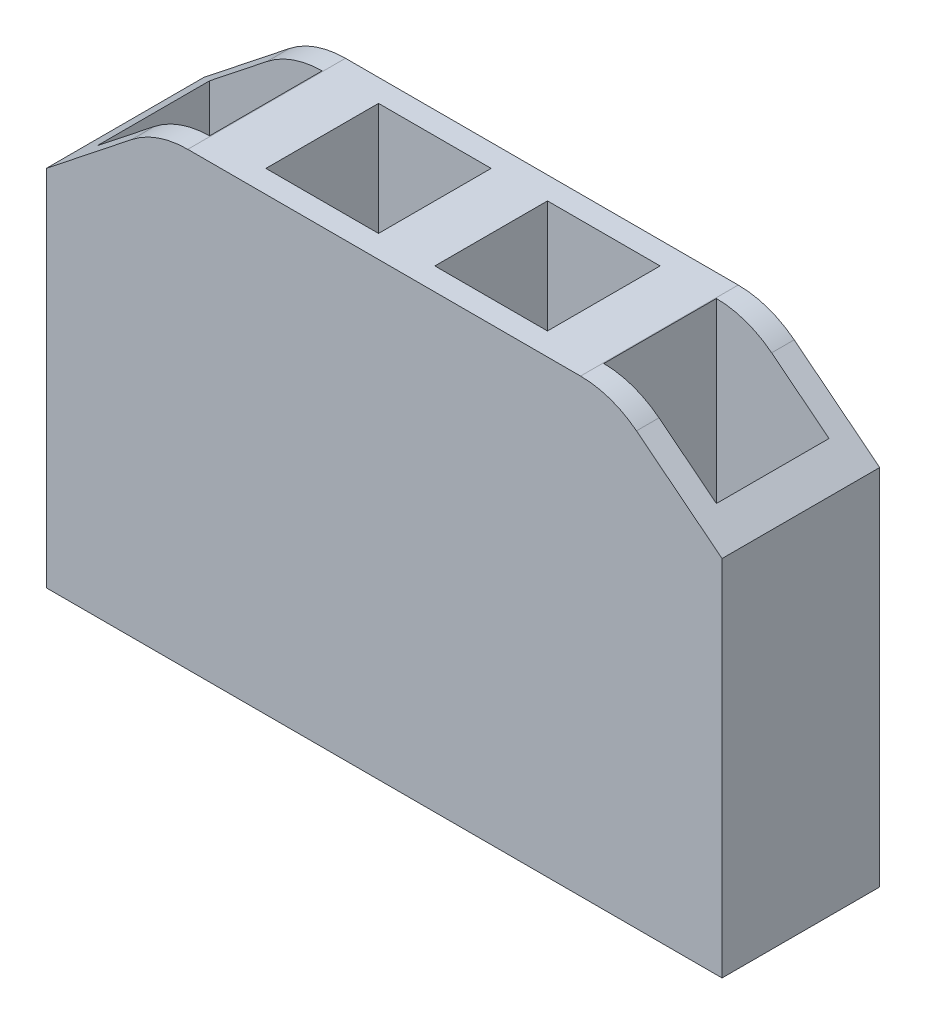
from build123d import *

# Parameters (mm, degrees)
SKETCH1_W               = 15
SKETCH1_H               = 3.5
BOSS_EXTRUDE1_DEPTH     = 10
CUT_EXTRUDE1_DEPTH      = 13.980754986
CUT_EXTRUDE1_DEPTH_BACK = 13.980754986
FILLET1_R               = 2
SKETCH3_W               = 2.5
SKETCH3_H               = 2.5
CUT_EXTRUDE2_DEPTH      = 8


with BuildPart() as part:
    # Sketch1 → Boss-Extrude1 (new body)
    with BuildSketch(Plane(origin=(0, 0, 0), x_dir=(1, 0, 0), z_dir=(0, 1, 0))):
        Rectangle(SKETCH1_W, SKETCH1_H)
    extrude(amount=BOSS_EXTRUDE1_DEPTH)

    # Sketch2 → Cut-Extrude1 (cut, two sides: drawn at the far end of the back side and taken through both)
    with BuildSketch(Plane.XY.offset(1.75).offset(-CUT_EXTRUDE1_DEPTH_BACK)):
        Polygon((-42.036351416, -19.295421035), (-7.5, 8.063187399), (-5.0550496, 10), (5.0550496, 10), (7.5, 8.063187399), (42.036351416, -19.295421035), (42.036351416, 68.823885013), (-42.036351416, 68.823885013), align=None)
    extrude(amount=CUT_EXTRUDE1_DEPTH + CUT_EXTRUDE1_DEPTH_BACK, mode=Mode.SUBTRACT)

    # Fillet1
    fillet1_edges = [part.edges().sort_by_distance(p)[0] for p in [
        (5.0550496, 10, 0),
        (-5.0550496, 10, 0),
    ]]
    fillet(fillet1_edges, radius=FILLET1_R)

    # Sketch3 → Cut-Extrude2 (cut)
    with BuildSketch(Plane(origin=(0, 10, 0), x_dir=(1, 0, 0), z_dir=(0, 1, 0))):
        with Locations((-1.875, 0)):
            Rectangle(SKETCH3_W, SKETCH3_H)
        with Locations((-5.625, 0)):
            Rectangle(SKETCH3_W, SKETCH3_H)
        with Locations((5.625, 0)):
            Rectangle(SKETCH3_W, SKETCH3_H)
        with Locations((1.875, 0)):
            Rectangle(SKETCH3_W, SKETCH3_H)
    extrude(amount=-CUT_EXTRUDE2_DEPTH, mode=Mode.SUBTRACT)


solid = part.part
